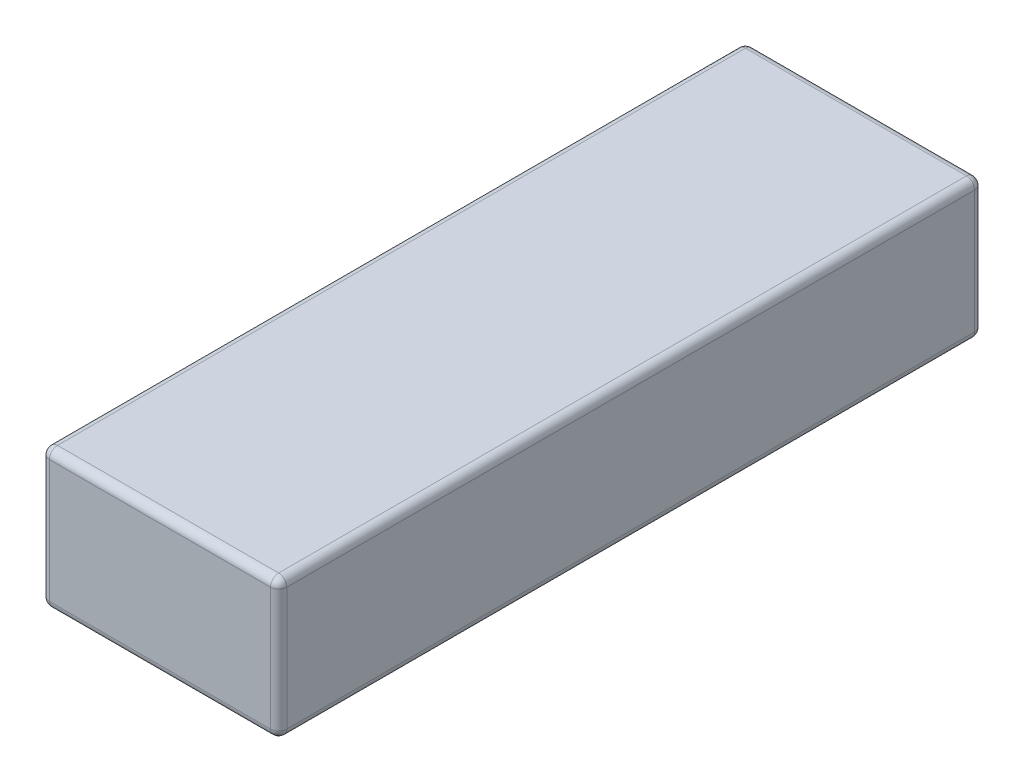
from build123d import *

# Parameters (mm, degrees)
SKETCH1_W           = 29
SKETCH1_H           = 17
BOSS_EXTRUDE1_DEPTH = 86
FILLET1_R           = 1


with BuildPart() as part:
    # Sketch1 → Boss-Extrude1 (new body)
    with BuildSketch(Plane.XY):
        Rectangle(SKETCH1_W, SKETCH1_H)
    extrude(amount=BOSS_EXTRUDE1_DEPTH)

    # Fillet1
    fillet1_edges = [part.edges().sort_by_distance(p)[0] for p in [
        (-14.5, 0, 86),
        (0, -8.5, 86),
        (14.5, 0, 86),
        (0, -8.5, 0),
        (-14.5, 0, 0),
        (0, 8.5, 0),
        (14.5, 0, 0),
        (14.5, -8.5, 43),
        (-14.5, -8.5, 43),
        (-14.5, 8.5, 43),
        (14.5, 8.5, 43),
        (0, 8.5, 86),
    ]]
    fillet(fillet1_edges, radius=FILLET1_R)


solid = part.part
